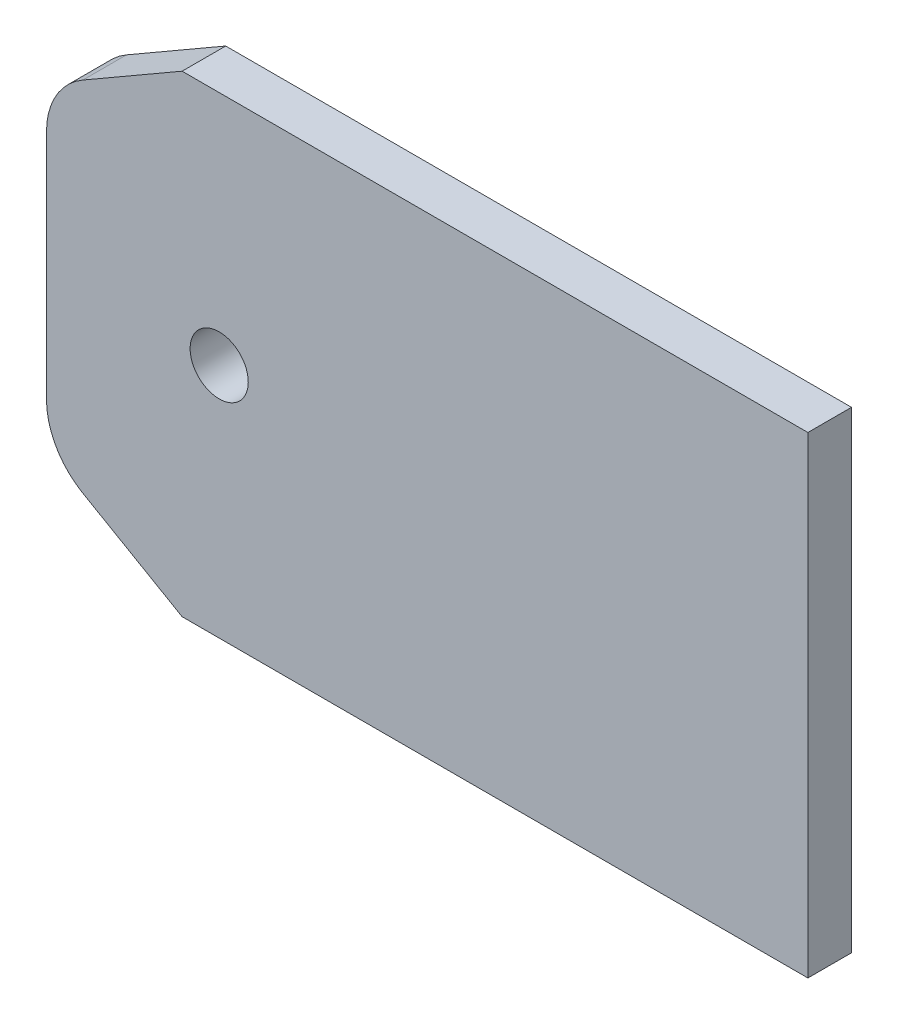
from build123d import *

# Parameters (mm, degrees)
SKETCH1_R           = 4
BOSS_EXTRUDE1_DEPTH = 6


with BuildPart() as part:
    # Sketch1 → Boss-Extrude1 (new body)
    with BuildSketch(Plane.XY):
        with BuildLine():
            Line((-37.787642532, 307.932576411), (-123.887642532, 307.932576411))
            Line((-123.887642532, 307.932576411), (-137.545094515, 300.047977161))
            ThreePointArc((-137.545094515, 300.047977161), (-141.205529316, 296.38770347), (-142.545348637, 291.387576411))
            Line((-142.545348637, 291.387576411), (-142.545348637, 259.477576411))
            ThreePointArc((-142.545348637, 259.477576411), (-141.205529316, 254.477449351), (-137.545094515, 250.817175661))
            Line((-137.545094515, 250.817175661), (-123.887642532, 242.932576411))
            Line((-123.887642532, 242.932576411), (-37.787642532, 242.932576411))
            Line((-37.787642532, 242.932576411), (-37.787642532, 307.932576411))
        make_face()
        with Locations((-118.785348637, 275.432576411)):
            Circle(SKETCH1_R, mode=Mode.SUBTRACT)
    extrude(amount=BOSS_EXTRUDE1_DEPTH)


solid = part.part
